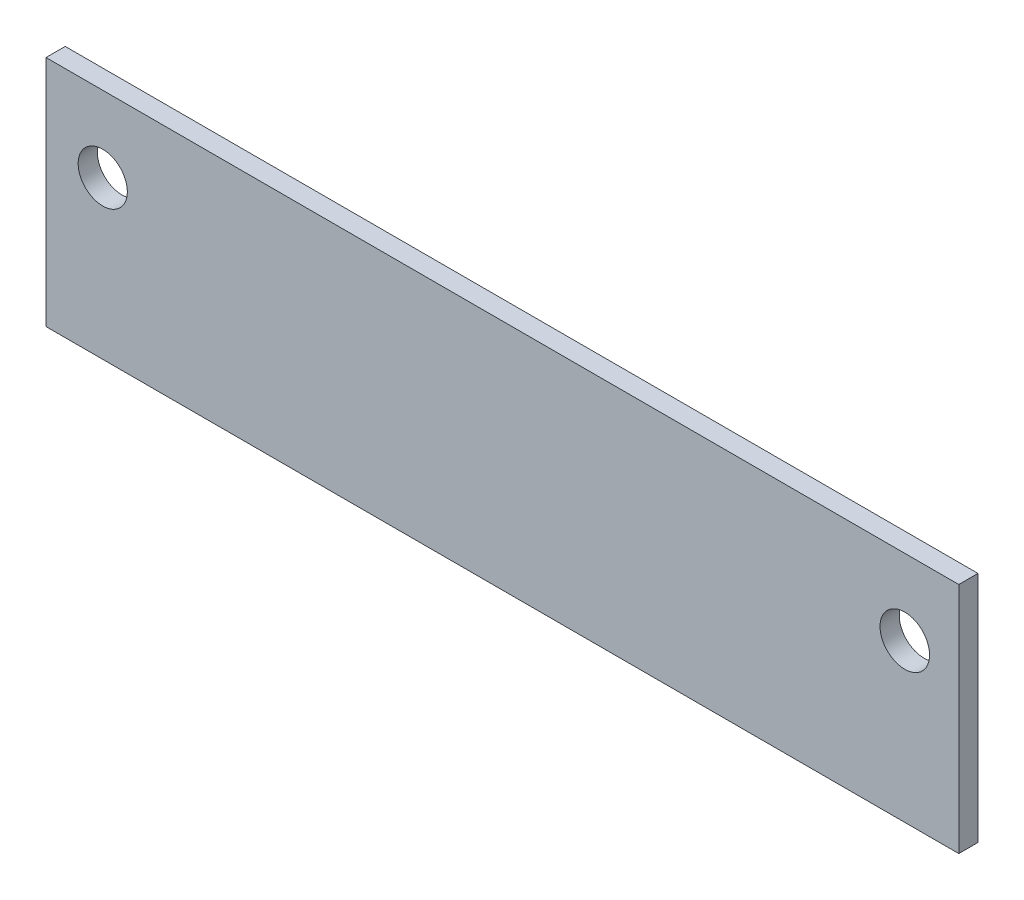
from build123d import *

# Parameters (mm, degrees)
SKETCH1_W           = 120.636949864
SKETCH1_H           = 30.799809453
SKETCH1_R           = 3.273423831
SKETCH1_R_2         = 3.25
BOSS_EXTRUDE1_DEPTH = 2.54


with BuildPart() as part:
    # Sketch1 → Boss-Extrude1 (new body)
    with BuildSketch(Plane.XY):
        with Locations((-0.181525068, -15.399904727)):
            Rectangle(SKETCH1_W, SKETCH1_H)
        with Locations((53, -10)):
            Circle(SKETCH1_R, mode=Mode.SUBTRACT)
        with Locations((-53, -10)):
            Circle(SKETCH1_R_2, mode=Mode.SUBTRACT)
    extrude(amount=BOSS_EXTRUDE1_DEPTH)


solid = part.part
